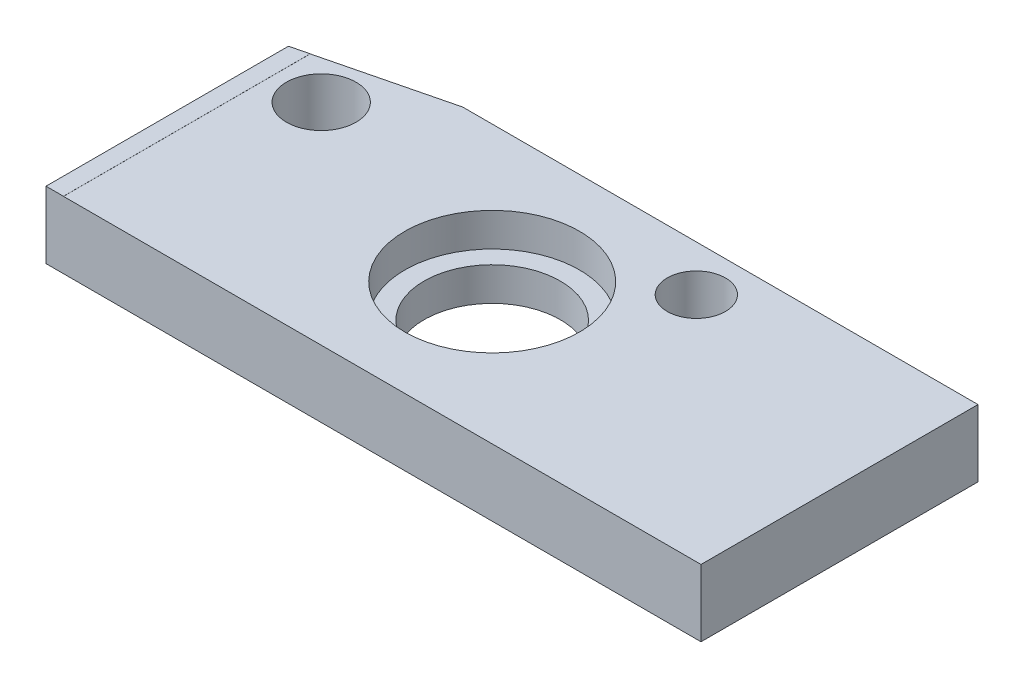
from build123d import *

# Parameters (mm, degrees)
SKETCH1_W               = 225.425
SKETCH1_H               = 100.69322
BOSS_EXTRUDE1_DEPTH     = 24.35352
SKETCH2_W               = 6.35
SKETCH2_H               = 24.385376466
BOSS_EXTRUDE2_DEPTH     = 100.69322
SKETCH3_W               = 6.35
SKETCH3_H               = 24.35352
BOSS_EXTRUDE3_DEPTH     = 100.69322
SKETCH4_R               = 12.64539
SKETCH4_R_2             = 10.58672
CUT_EXTRUDE1_DEPTH      = 254.873726713
CUT_EXTRUDE2_DEPTH      = 254.876784611
CUT_EXTRUDE2_DEPTH_BACK = 254.876784611
SKETCH16_R              = 31.75
SKETCH16_R_2            = 24.765
CUT_EXTRUDE6_DEPTH      = 12.17676
SKETCH17_R              = 24.765
CUT_EXTRUDE7_DEPTH      = 254.873726713


with BuildPart() as part:
    # Sketch1 → Boss-Extrude1 (new body)
    with BuildSketch(Plane(origin=(0, 0, 0), x_dir=(1, 0, 0), z_dir=(0, 1, 0))):
        with Locations((112.7125, 50.34661)):
            Rectangle(SKETCH1_W, SKETCH1_H)
    extrude(amount=BOSS_EXTRUDE1_DEPTH)

    # Sketch2 → Boss-Extrude2 (add)
    with BuildSketch(Plane.XY.offset(-100.69322)):
        with Locations((-3.175, 12.192688233)):
            Rectangle(SKETCH2_W, SKETCH2_H)
    extrude(amount=BOSS_EXTRUDE2_DEPTH)

    # Sketch3 → Boss-Extrude3 (add)
    with BuildSketch(Plane(origin=(225.425, 0, -100.69322), x_dir=(-1, 0, 0), z_dir=(0, 0, -1))):
        with Locations((-3.175, 12.17676)):
            Rectangle(SKETCH3_W, SKETCH3_H)
    extrude(amount=-BOSS_EXTRUDE3_DEPTH)

    # Sketch4 → Cut-Extrude1 (cut, through all)
    with BuildSketch(Plane(origin=(0, 24.35352, 0), x_dir=(1, 0, 0), z_dir=(0, 1, 0))):
        with Locations(Location((17.2085, 76.49718, 0), (0, 0, 270))):
            Circle(SKETCH4_R)
        with Locations(Location((145.99666, 84.074, 0), (0, 0, 270))):
            Circle(SKETCH4_R_2)
    extrude(amount=-CUT_EXTRUDE1_DEPTH, mode=Mode.SUBTRACT)

    # Sketch5 → Cut-Extrude2 (cut, two sides: drawn at the far end of the back side and taken through both)
    with BuildSketch(Plane(origin=(0, 24.385376466, 0), x_dir=(1, 0, 0), z_dir=(0, 1, 0)).offset(-CUT_EXTRUDE2_DEPTH_BACK)):
        Polygon((-509.055541284, -36.086678247), (-6.35, 88.139743453), (44.45, 100.69322), (547.155541284, 224.9196417), (298.702697883, 1230.330724268), (-757.508384685, 969.324404321), align=None)
    extrude(amount=CUT_EXTRUDE2_DEPTH + CUT_EXTRUDE2_DEPTH_BACK, mode=Mode.SUBTRACT)

    # Sketch16 → Cut-Extrude6 (cut)
    with BuildSketch(Plane(origin=(0, 24.35352, 0), x_dir=(1, 0, 0), z_dir=(0, 1, 0))):
        with Locations(Location((104.78262, 51.0794, 0), (0, 0, 270))):
            Circle(SKETCH16_R)
        with Locations(Location((104.78262, 51.0794, 0), (0, 0, 270))):
            Circle(SKETCH16_R_2, mode=Mode.SUBTRACT)
    extrude(amount=-CUT_EXTRUDE6_DEPTH, mode=Mode.SUBTRACT)

    # Sketch17 → Cut-Extrude7 (cut, through all)
    with BuildSketch(Plane(origin=(0, 24.35352, 0), x_dir=(1, 0, 0), z_dir=(0, 1, 0))):
        with Locations(Location((104.78262, 51.0794, 0), (0, 0, 270))):
            Circle(SKETCH17_R)
    extrude(amount=-CUT_EXTRUDE7_DEPTH, mode=Mode.SUBTRACT)


solid = part.part
